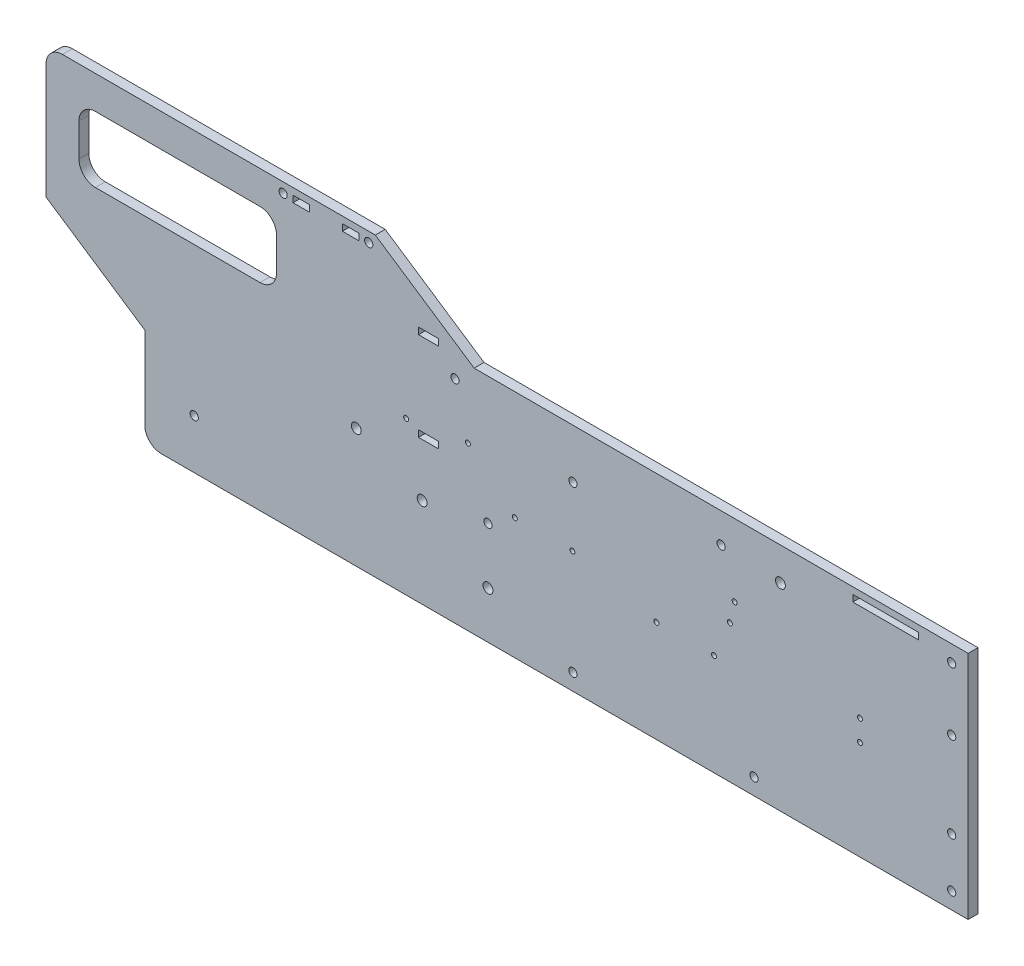
from build123d import *

# Parameters (mm, degrees)
SKETCH1_R           = 1.25
SKETCH1_R_2         = 0.75
SKETCH1_W           = 60
SKETCH1_H           = 20
SKETCH1_W_2         = 5
SKETCH1_H_2         = 1
BOSS_EXTRUDE2_DEPTH = 3
SKETCH4_R           = 0.75
CUT_EXTRUDE3_DEPTH  = 3
SKETCH5_R           = 0.75
CUT_EXTRUDE4_DEPTH  = 3
SKETCH14_R          = 0.75
CUT_EXTRUDE12_DEPTH = 10
BOSS_EXTRUDE4_START = -3
SKETCH15_R          = 0.75
BOSS_EXTRUDE4_DEPTH = 3
SKETCH20_R          = 1.25
CUT_EXTRUDE17_DEPTH = 3
SKETCH23_R          = 0.75
CUT_EXTRUDE21_DEPTH = 10
SKETCH25_W          = 10
SKETCH25_H          = 1
CUT_EXTRUDE23_DEPTH = 3
SKETCH26_R          = 1.25
CUT_EXTRUDE24_DEPTH = 3
SKETCH29_R          = 1.25
CUT_EXTRUDE27_DEPTH = 3
SKETCH33_W          = 5
SKETCH33_H          = 2
CUT_EXTRUDE31_DEPTH = 3
SKETCH34_W          = 5
SKETCH34_H          = 2
CUT_EXTRUDE32_DEPTH = 3
SKETCH35_R          = 1.25
CUT_EXTRUDE33_DEPTH = 3
SKETCH37_R          = 1.25
CUT_EXTRUDE34_DEPTH = 3
SKETCH38_R          = 1.25
CUT_EXTRUDE35_DEPTH = 3
SKETCH41_R          = 0.75
CUT_EXTRUDE38_DEPTH = 3
SKETCH42_W          = 6
SKETCH42_H          = 2
CUT_EXTRUDE40_DEPTH = 3
SKETCH43_W          = 6
SKETCH43_H          = 2
CUT_EXTRUDE41_DEPTH = 3
BOSS_EXTRUDE5_START = -3
SKETCH45_R          = 1.25
BOSS_EXTRUDE5_DEPTH = 3
BOSS_EXTRUDE6_START = -3
SKETCH46_R          = 1.25
BOSS_EXTRUDE6_DEPTH = 3
SKETCH47_R          = 1.25
CUT_EXTRUDE42_DEPTH = 3
SKETCH49_R          = 1.25
CUT_EXTRUDE43_DEPTH = 3
SKETCH51_R          = 1.25
CUT_EXTRUDE44_DEPTH = 3
SKETCH52_R          = 1.25
CUT_EXTRUDE45_DEPTH = 3
SKETCH53_R          = 1.25
CUT_EXTRUDE46_DEPTH = 3
SKETCH54_R          = 1.25
CUT_EXTRUDE47_DEPTH = 3
SKETCH55_W          = 20
SKETCH55_H          = 1
CUT_EXTRUDE48_DEPTH = 10
SKETCH56_R          = 0.75
CUT_EXTRUDE49_DEPTH = 10
SKETCH57_R          = 0.75
CUT_EXTRUDE50_DEPTH = 10
SKETCH59_R          = 1.5
CUT_EXTRUDE51_DEPTH = 10
SKETCH60_R          = 0.75
CUT_EXTRUDE52_DEPTH = 10
SKETCH61_R          = 0.75
CUT_EXTRUDE53_DEPTH = 10
SKETCH65_R          = 1.5
CUT_EXTRUDE55_DEPTH = 10
SKETCH66_R          = 1.5
CUT_EXTRUDE56_DEPTH = 10
SKETCH67_R          = 1.5
CUT_EXTRUDE57_DEPTH = 10
CUT_EXTRUDE58_DEPTH = 10
CUT_EXTRUDE59_DEPTH = 10
BOSS_EXTRUDE7_DEPTH = 3


with BuildPart() as part:
    # Sketch1 → Boss-Extrude2 (new body)
    with BuildSketch(Plane.XY):
        Polygon((58.345821786, 13.119852123), (58.345821786, -56.880147877), (-191.654178214, -56.880147877), (-191.654178214, -26.880147877), (-221.654178214, -6.880147877), (-221.654178214, 33.119852123), (-121.654178214, 33.119852123), (-91.654178214, 13.119852123), align=None)
        with Locations((53.345821786, 7.945541925)):
            Circle(SKETCH1_R, mode=Mode.SUBTRACT)
        with Locations((53.345821786, -52.054458075)):
            Circle(SKETCH1_R, mode=Mode.SUBTRACT)
        with Locations((25.505821786, -18.330147877)):
            Circle(SKETCH1_R_2, mode=Mode.SUBTRACT)
        with Locations((-181.654178214, 13.119852123)):
            Rectangle(SKETCH1_W, SKETCH1_H, mode=Mode.SUBTRACT)
        with Locations((25.845821786, 10.619852123)):
            Rectangle(SKETCH1_W_2, SKETCH1_H_2, mode=Mode.SUBTRACT)
        with Locations((40.845821786, 10.619852123)):
            Rectangle(SKETCH1_W_2, SKETCH1_H_2, mode=Mode.SUBTRACT)
    extrude(amount=BOSS_EXTRUDE2_DEPTH)

    # Sketch4 → Cut-Extrude3 (cut)
    with BuildSketch(Plane.XY.offset(3)):
        with Locations((-12.554178214, -8.780147877)):
            Circle(SKETCH4_R)
    extrude(amount=-CUT_EXTRUDE3_DEPTH, mode=Mode.SUBTRACT)

    # Sketch5 → Cut-Extrude4 (cut)
    with BuildSketch(Plane.XY.offset(3)):
        with Locations((-13.994178214, -15.020147877)):
            Circle(SKETCH5_R)
    extrude(amount=-CUT_EXTRUDE4_DEPTH, mode=Mode.SUBTRACT)

    # Sketch14 → Cut-Extrude12 (cut)
    with BuildSketch(Plane.XY.offset(3)):
        with Locations((25.505821786, -20.330147877)):
            Circle(SKETCH14_R)
        with Locations((25.505821786, -26.730147877)):
            Circle(SKETCH14_R)
    extrude(amount=-CUT_EXTRUDE12_DEPTH, mode=Mode.SUBTRACT)

    # Sketch15 → Boss-Extrude4 (add)
    with BuildSketch(Plane.XY.offset(3).offset(BOSS_EXTRUDE4_START)):
        with Locations((25.505821786, -18.330147877)):
            Circle(SKETCH15_R)
    extrude(amount=BOSS_EXTRUDE4_DEPTH)

    # Sketch20 → Cut-Extrude17 (cut)
    with BuildSketch(Plane.XY.offset(3)):
        with Locations((-16.654178214, 4.119852123)):
            Circle(SKETCH20_R)
    extrude(amount=-CUT_EXTRUDE17_DEPTH, mode=Mode.SUBTRACT)

    # Sketch23 → Cut-Extrude21 (cut)
    with BuildSketch(Plane.XY.offset(3)):
        with Locations((-93.524701832, -7.521447448)):
            Circle(SKETCH23_R)
    extrude(amount=-CUT_EXTRUDE21_DEPTH, mode=Mode.SUBTRACT)

    # Sketch25 → Cut-Extrude23 (cut)
    with BuildSketch(Plane.XY.offset(3)):
        with Locations((33.345821786, 10.619852123)):
            Rectangle(SKETCH25_W, SKETCH25_H)
    extrude(amount=-CUT_EXTRUDE23_DEPTH, mode=Mode.SUBTRACT)

    # Sketch26 → Cut-Extrude24 (cut)
    with BuildSketch(Plane.XY.offset(3)):
        with Locations((-97.444178214, 7.419852123)):
            Circle(SKETCH26_R)
    extrude(amount=-CUT_EXTRUDE24_DEPTH, mode=Mode.SUBTRACT)

    # Sketch29 → Cut-Extrude27 (cut)
    with BuildSketch(Plane.XY.offset(3)):
        with Locations((-176.654178214, -41.880147877)):
            Circle(SKETCH29_R)
    extrude(amount=-CUT_EXTRUDE27_DEPTH, mode=Mode.SUBTRACT)

    # Sketch33 → Cut-Extrude31 (cut)
    with BuildSketch(Plane.XY.offset(3)):
        with Locations((-129.154178214, 30.119852123)):
            Rectangle(SKETCH33_W, SKETCH33_H)
    extrude(amount=-CUT_EXTRUDE31_DEPTH, mode=Mode.SUBTRACT)

    # Sketch34 → Cut-Extrude32 (cut)
    with BuildSketch(Plane.XY.offset(3)):
        with Locations((-144.154178214, 30.119852123)):
            Rectangle(SKETCH34_W, SKETCH34_H)
    extrude(amount=-CUT_EXTRUDE32_DEPTH, mode=Mode.SUBTRACT)

    # Sketch35 → Cut-Extrude33 (cut)
    with BuildSketch(Plane.XY.offset(3)):
        with Locations((-123.654178214, 30.119852123)):
            Circle(SKETCH35_R)
        with Locations((-149.654178214, 30.119852123)):
            Circle(SKETCH35_R)
    extrude(amount=-CUT_EXTRUDE33_DEPTH, mode=Mode.SUBTRACT)

    # Sketch37 → Cut-Extrude34 (cut)
    with BuildSketch(Plane.XY.offset(3)):
        with Locations((-61.654178214, -1.880147877)):
            Circle(SKETCH37_R)
    extrude(amount=-CUT_EXTRUDE34_DEPTH, mode=Mode.SUBTRACT)

    # Sketch38 → Cut-Extrude35 (cut)
    with BuildSketch(Plane.XY.offset(3)):
        with Locations((-87.444178214, -25.580147877)):
            Circle(SKETCH38_R)
    extrude(amount=-CUT_EXTRUDE35_DEPTH, mode=Mode.SUBTRACT)

    # Sketch41 → Cut-Extrude38 (cut)
    with BuildSketch(Plane.XY.offset(3)):
        with Locations((-112.306137726, -10.395062897)):
            Circle(SKETCH41_R)
    extrude(amount=-CUT_EXTRUDE38_DEPTH, mode=Mode.SUBTRACT)

    # Sketch42 → Cut-Extrude40 (cut)
    with BuildSketch(Plane.XY.offset(3)):
        with Locations((-105.524701832, -12.521447448)):
            Rectangle(SKETCH42_W, SKETCH42_H)
    extrude(amount=-CUT_EXTRUDE40_DEPTH, mode=Mode.SUBTRACT)

    # Sketch43 → Cut-Extrude41 (cut)
    with BuildSketch(Plane.XY.offset(3)):
        with Locations((-105.524701832, 14.478552552)):
            Rectangle(SKETCH43_W, SKETCH43_H)
    extrude(amount=-CUT_EXTRUDE41_DEPTH, mode=Mode.SUBTRACT)

    # Sketch45 → Boss-Extrude5 (add)
    with BuildSketch(Plane.XY.offset(3).offset(BOSS_EXTRUDE5_START)):
        with Locations((53.345821786, -52.054458075)):
            Circle(SKETCH45_R)
    extrude(amount=BOSS_EXTRUDE5_DEPTH)

    # Sketch46 → Boss-Extrude6 (add)
    with BuildSketch(Plane.XY.offset(3).offset(BOSS_EXTRUDE6_START)):
        with Locations((53.345821786, 7.945541925)):
            Circle(SKETCH46_R)
    extrude(amount=BOSS_EXTRUDE6_DEPTH)

    # Sketch47 → Cut-Extrude42 (cut)
    with BuildSketch(Plane.XY.offset(3)):
        with Locations((53.345821786, 8.119852123)):
            Circle(SKETCH47_R)
    extrude(amount=-CUT_EXTRUDE42_DEPTH, mode=Mode.SUBTRACT)

    # Sketch49 → Cut-Extrude43 (cut)
    with BuildSketch(Plane.XY.offset(3)):
        with Locations((53.345821786, -10.880147877)):
            Circle(SKETCH49_R)
    extrude(amount=-CUT_EXTRUDE43_DEPTH, mode=Mode.SUBTRACT)

    # Sketch51 → Cut-Extrude44 (cut)
    with BuildSketch(Plane.XY.offset(3)):
        with Locations((53.345821786, -36.880147877)):
            Circle(SKETCH51_R)
    extrude(amount=-CUT_EXTRUDE44_DEPTH, mode=Mode.SUBTRACT)

    # Sketch52 → Cut-Extrude45 (cut)
    with BuildSketch(Plane.XY.offset(3)):
        with Locations((53.345821786, -51.880147877)):
            Circle(SKETCH52_R)
    extrude(amount=-CUT_EXTRUDE45_DEPTH, mode=Mode.SUBTRACT)

    # Sketch53 → Cut-Extrude46 (cut)
    with BuildSketch(Plane.XY.offset(3)):
        with Locations((-6.654178214, -51.880147877)):
            Circle(SKETCH53_R)
    extrude(amount=-CUT_EXTRUDE46_DEPTH, mode=Mode.SUBTRACT)

    # Sketch54 → Cut-Extrude47 (cut)
    with BuildSketch(Plane.XY.offset(3)):
        with Locations((-61.654178214, -51.880147877)):
            Circle(SKETCH54_R)
    extrude(amount=-CUT_EXTRUDE47_DEPTH, mode=Mode.SUBTRACT)

    # Sketch55 → Cut-Extrude48 (cut)
    with BuildSketch(Plane.XY.offset(3)):
        with Locations((33.345821786, 9.619852123)):
            Rectangle(SKETCH55_W, SKETCH55_H)
    extrude(amount=-CUT_EXTRUDE48_DEPTH, mode=Mode.SUBTRACT)

    # Sketch56 → Cut-Extrude49 (cut)
    with BuildSketch(Plane.XY.offset(3)):
        with Locations((-61.804178214, -20.030147877)):
            Circle(SKETCH56_R)
    extrude(amount=-CUT_EXTRUDE49_DEPTH, mode=Mode.SUBTRACT)

    # Sketch57 → Cut-Extrude50 (cut)
    with BuildSketch(Plane.XY.offset(3)):
        with Locations((-79.304178214, -20.030147877)):
            Circle(SKETCH57_R)
    extrude(amount=-CUT_EXTRUDE50_DEPTH, mode=Mode.SUBTRACT)

    # Sketch59 → Cut-Extrude51 (cut)
    with BuildSketch(Plane.XY.offset(3)):
        with Locations((-87.444178214, -42.580147877)):
            Circle(SKETCH59_R)
    extrude(amount=-CUT_EXTRUDE51_DEPTH, mode=Mode.SUBTRACT)

    # Sketch60 → Cut-Extrude52 (cut)
    with BuildSketch(Plane.XY.offset(3)):
        with Locations((-18.804178214, -26.030147877)):
            Circle(SKETCH60_R)
    extrude(amount=-CUT_EXTRUDE52_DEPTH, mode=Mode.SUBTRACT)

    # Sketch61 → Cut-Extrude53 (cut)
    with BuildSketch(Plane.XY.offset(3)):
        with Locations((-36.304178214, -26.030147877)):
            Circle(SKETCH61_R)
    extrude(amount=-CUT_EXTRUDE53_DEPTH, mode=Mode.SUBTRACT)

    # Sketch65 → Cut-Extrude55 (cut)
    with BuildSketch(Plane.XY.offset(3)):
        with Locations((1.345821786, 3.119852123)):
            Circle(SKETCH65_R)
    extrude(amount=-CUT_EXTRUDE55_DEPTH, mode=Mode.SUBTRACT)

    # Sketch66 → Cut-Extrude56 (cut)
    with BuildSketch(Plane.XY.offset(3)):
        with Locations((-107.444178214, -29.580147877)):
            Circle(SKETCH66_R)
    extrude(amount=-CUT_EXTRUDE56_DEPTH, mode=Mode.SUBTRACT)

    # Sketch67 → Cut-Extrude57 (cut)
    with BuildSketch(Plane.XY.offset(3)):
        with Locations((-127.444178214, -20.580147877)):
            Circle(SKETCH67_R)
    extrude(amount=-CUT_EXTRUDE57_DEPTH, mode=Mode.SUBTRACT)

    # Sketch68 → Cut-Extrude58 (cut)
    with BuildSketch(Plane.XY.offset(3)):
        with BuildLine():
            Line((-221.654178214, 33.119852123), (-216.654178214, 33.119852123))
            ThreePointArc((-216.654178214, 33.119852123), (-220.18971212, 31.655386029), (-221.654178214, 28.119852123))
            Line((-221.654178214, 28.119852123), (-221.654178214, 33.119852123))
        make_face()
    extrude(amount=-CUT_EXTRUDE58_DEPTH, mode=Mode.SUBTRACT)

    # Sketch69 → Cut-Extrude59 (cut)
    with BuildSketch(Plane.XY.offset(3)):
        with BuildLine():
            Line((-191.654178214, -56.880147877), (-191.654178214, -51.880147877))
            ThreePointArc((-191.654178214, -51.880147877), (-190.18971212, -55.415681783), (-186.654178214, -56.880147877))
            Line((-186.654178214, -56.880147877), (-191.654178214, -56.880147877))
        make_face()
    extrude(amount=-CUT_EXTRUDE59_DEPTH, mode=Mode.SUBTRACT)

    # Sketch72 → Boss-Extrude7 (add)
    with BuildSketch(Plane.XY.offset(3)):
        with BuildLine():
            Line((-211.654178214, 23.119852123), (-211.654178214, 18.119852123))
            ThreePointArc((-211.654178214, 18.119852123), (-210.18971212, 21.655386029), (-206.654178214, 23.119852123))
            Line((-206.654178214, 23.119852123), (-211.654178214, 23.119852123))
        make_face()
        with BuildLine():
            Line((-211.654178214, 3.119852123), (-211.654178214, 8.119852123))
            ThreePointArc((-211.654178214, 8.119852123), (-210.18971212, 4.584318217), (-206.654178214, 3.119852123))
            Line((-206.654178214, 3.119852123), (-211.654178214, 3.119852123))
        make_face()
        with BuildLine():
            Line((-151.654178214, 23.119852123), (-156.654178214, 23.119852123))
            ThreePointArc((-156.654178214, 23.119852123), (-153.118644308, 21.655386029), (-151.654178214, 18.119852123))
            Line((-151.654178214, 18.119852123), (-151.654178214, 23.119852123))
        make_face()
        with BuildLine():
            Line((-151.654178214, 3.119852123), (-156.654178214, 3.119852123))
            ThreePointArc((-156.654178214, 3.119852123), (-153.118644308, 4.584318217), (-151.654178214, 8.119852123))
            Line((-151.654178214, 8.119852123), (-151.654178214, 3.119852123))
        make_face()
    extrude(amount=-BOSS_EXTRUDE7_DEPTH)


solid = part.part
